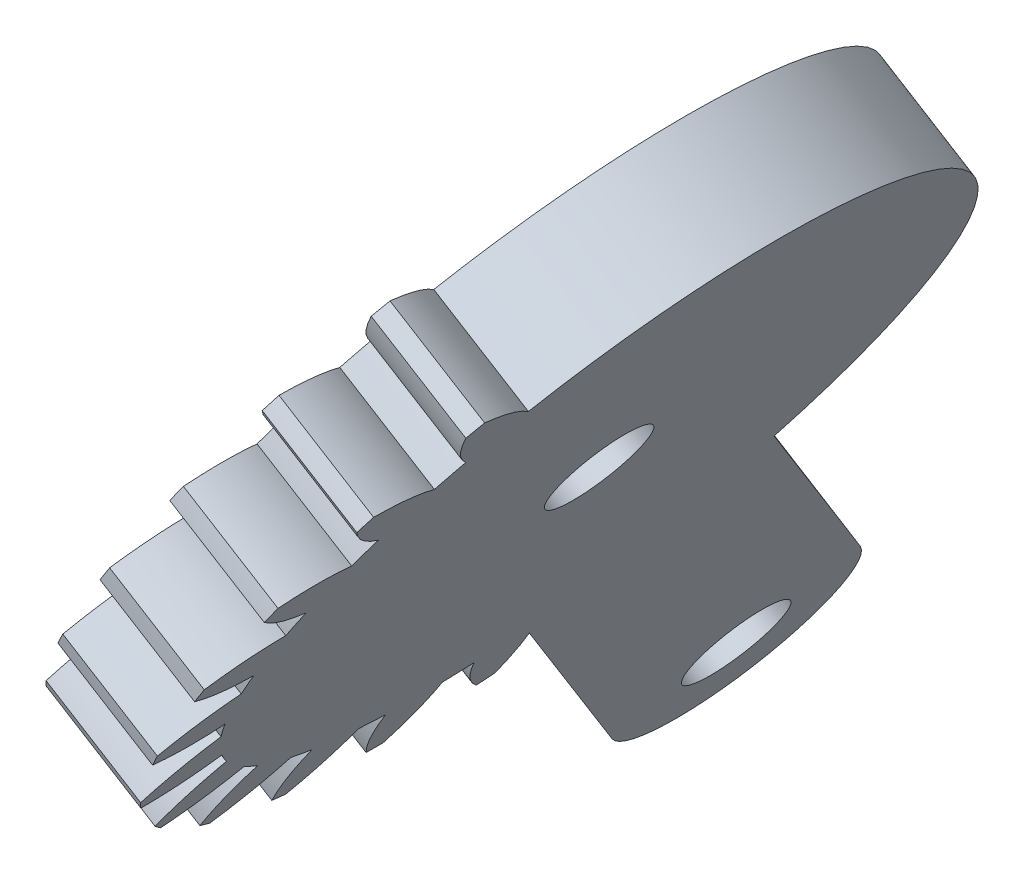
from build123d import *

# Parameters (mm, degrees)
SKETCH1_R           = 1.75
BOSS_EXTRUDE1_DEPTH = 4


with BuildPart() as part:
    # Sketch1 → Boss-Extrude1 (new body)
    with BuildSketch(Plane(origin=(-201.849311144, 125.418002604, 0.593848714), x_dir=(0.5277644625295504, 0.8493907652493609, 0), z_dir=(0.8493881131629331, -0.5277628146696661, -0.0024989336654472707))):
        with BuildLine():
            Line((130.945060734, 58.809848208), (146.579838304, 70.190117076))
            ThreePointArc((146.579838304, 70.190117076), (162.295773548, 71.891920972), (162.900286711, 87.688164859))
            ThreePointArc((162.900286711, 87.688164859), (163.727217564, 88.752283823), (164.264905418, 89.988024724))
            ThreePointArc((164.264905418, 89.988024724), (164.052294272, 90.216510947), (163.834855807, 90.440408172))
            ThreePointArc((163.834855807, 90.440408172), (162.573497364, 89.965920361), (161.468909378, 89.193878143))
            ThreePointArc((161.468909378, 89.193878143), (161.054495731, 89.544530901), (160.624762365, 89.876231461))
            ThreePointArc((160.624762365, 89.876231461), (161.148101979, 91.118116903), (161.347635283, 92.450914812))
            ThreePointArc((161.347635283, 92.450914812), (161.083132101, 92.616587742), (160.815153805, 92.776578637))
            ThreePointArc((160.815153805, 92.776578637), (159.719581591, 91.991795019), (158.852450758, 90.960171094))
            ThreePointArc((158.852450758, 90.960171094), (158.361402302, 91.191617504), (157.860461322, 91.400792462))
            ThreePointArc((157.860461322, 91.400792462), (158.044544967, 92.735811944), (157.892325857, 94.074838884))
            ThreePointArc((157.892325857, 94.074838884), (157.593956092, 94.166408185), (157.293700245, 94.251589636))
            ThreePointArc((157.293700245, 94.251589636), (156.438575695, 93.209991917), (155.867995548, 91.98908975))
            ThreePointArc((155.867995548, 91.98908975), (155.333776423, 92.085557123), (154.795766131, 92.157951551))
            ThreePointArc((154.795766131, 92.157951551), (154.62804881, 93.4951257), (154.134450767, 94.749129199))
            ThreePointArc((154.134450767, 94.749129199), (153.822547826, 94.760354574), (153.510476367, 94.764921606))
            ThreePointArc((153.510476367, 94.764921606), (152.954074807, 93.537492949), (152.71892944, 92.210515006))
            ThreePointArc((152.71892944, 92.210515006), (152.177945797, 92.165429249), (151.639530704, 92.096109587))
            ThreePointArc((151.639530704, 92.096109587), (151.131442076, 93.344312194), (150.330102989, 94.427833986))
            ThreePointArc((150.330102989, 94.427833986), (150.025922543, 94.357950445), (149.723302626, 94.281591822))
            ThreePointArc((149.723302626, 94.281591822), (149.503541902, 92.951979462), (149.619856083, 91.609357096))
            ThreePointArc((149.619856083, 91.609357096), (149.108975064, 91.425790729), (148.606847269, 91.219480997))
            ThreePointArc((148.606847269, 91.219480997), (147.793012734, 92.293649118), (146.73854254, 93.132848983))
            ThreePointArc((146.73854254, 93.132848983), (146.462813982, 92.986618973), (146.190268655, 92.834538409))
            ThreePointArc((146.190268655, 92.834538409), (146.322125097, 91.493353231), (146.781972207, 90.226583939))
            ThreePointArc((146.781972207, 90.226583939), (146.336009508, 89.917046706), (145.904388191, 89.587806571))
            ThreePointArc((145.904388191, 89.587806571), (144.840269228, 90.414737424), (143.604528326, 90.952425278))
            ThreePointArc((143.604528326, 90.952425278), (143.376042103, 90.739814133), (143.152144879, 90.522375667))
            ThreePointArc((143.152144879, 90.522375667), (143.626632689, 89.261017224), (144.398674907, 88.156429239))
            ThreePointArc((144.398674907, 88.156429239), (144.04802215, 87.742015592), (143.71632159, 87.312282225))
            ThreePointArc((143.71632159, 87.312282225), (142.474436147, 87.835621839), (141.141638239, 88.035155143))
            ThreePointArc((141.141638239, 88.035155143), (140.975965308, 87.770651961), (140.815974413, 87.502673666))
            ThreePointArc((140.815974413, 87.502673666), (141.600758031, 86.407101451), (142.632381956, 85.539970619))
            ThreePointArc((142.632381956, 85.539970619), (142.400935546, 85.048922162), (142.191760588, 84.547981183))
            ThreePointArc((142.191760588, 84.547981183), (140.856741107, 84.732064827), (139.517714167, 84.579845717))
            ThreePointArc((139.517714167, 84.579845717), (139.426144866, 84.281475953), (139.340963414, 83.981220105))
            ThreePointArc((139.340963414, 83.981220105), (140.382561133, 83.126095556), (141.6034633, 82.555515409))
            ThreePointArc((141.6034633, 82.555515409), (141.506995927, 82.021296284), (141.434601499, 81.483285992))
            ThreePointArc((141.434601499, 81.483285992), (140.097427351, 81.315568671), (138.843423852, 80.821970627))
            ThreePointArc((138.843423852, 80.821970627), (138.832198476, 80.510067686), (138.827631445, 80.197996227))
            ThreePointArc((138.827631445, 80.197996227), (140.055060101, 79.641594667), (141.382038044, 79.4064493))
            ThreePointArc((141.382038044, 79.4064493), (141.427123801, 78.865465657), (141.496443464, 78.327050564))
            ThreePointArc((141.496443464, 78.327050564), (140.248240856, 77.818961936), (139.164719064, 77.01762285))
            ThreePointArc((139.164719064, 77.01762285), (139.234602606, 76.713442403), (139.310961229, 76.410822487))
            ThreePointArc((139.310961229, 76.410822487), (140.268246, 76.218389895), (141.244534321, 76.201491708))
            Line((141.244534321, 76.201491708), (126.237111203, 65.27786268))
            ThreePointArc((126.237111203, 65.27786268), (125.357078733, 59.689880678), (130.945060734, 58.809848208))
        make_face()
        with Locations(Location((153.452516595, 80.140036455, 0), (0, 0, 180))):
            Circle(SKETCH1_R, mode=Mode.SUBTRACT)
        with Locations(Location((128.591085969, 62.043855444, 0), (0, 0, 180))):
            Circle(SKETCH1_R, mode=Mode.SUBTRACT)
    extrude(amount=-BOSS_EXTRUDE1_DEPTH)


solid = part.part
